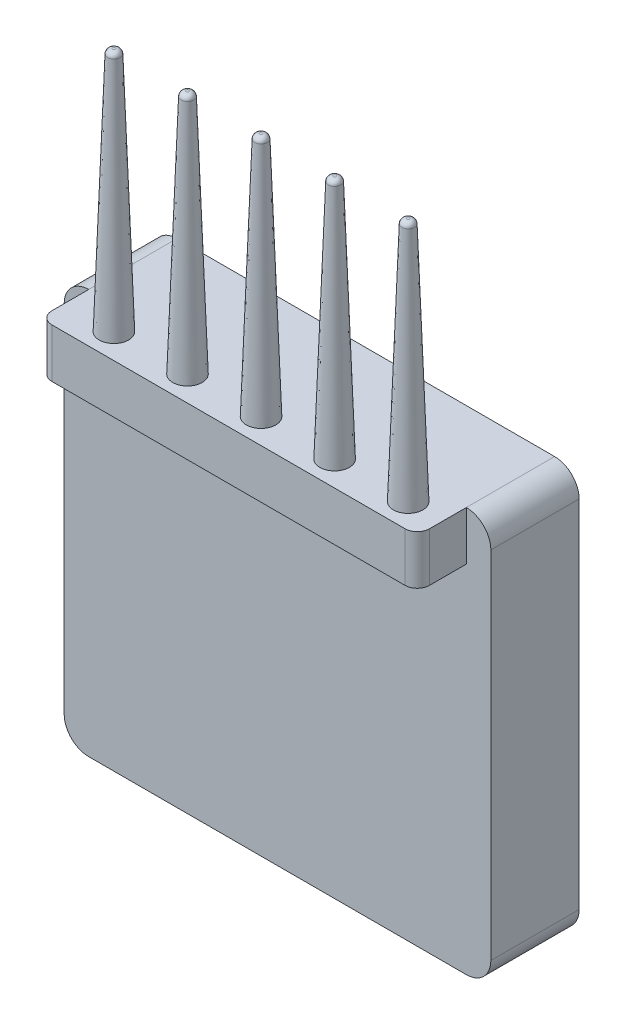
from build123d import *

# Parameters (mm, degrees)
EXTRUDE_1_DEPTH           = 36
SKETCH_3_W                = 154
SKETCH_3_H                = 20
EXTRUDE_4_DEPTH           = 20
SKETCH_4_R                = 6
EXTRUDE_5_DEPTH           = 100
EXTRUDE_5_DRAFT           = 2
EXTRUDE_5_PROFILE_2_DEPTH = 100
EXTRUDE_5_PROFILE_2_DRAFT = 2
EXTRUDE_5_PROFILE_3_DEPTH = 100
EXTRUDE_5_PROFILE_3_DRAFT = 2
EXTRUDE_5_PROFILE_4_DEPTH = 100
EXTRUDE_5_PROFILE_4_DRAFT = 2
EXTRUDE_5_PROFILE_5_DEPTH = 100
EXTRUDE_5_PROFILE_5_DRAFT = 2
FILLET_1_R                = 2
FILLET_2_R                = 5


with BuildPart() as part:
    # 스케치1 → 보스-돌출1 (new body)
    with BuildSketch(Plane.XY):
        with BuildLine():
            Line((-77, -82.5), (77, -82.5))
            ThreePointArc((77, -82.5), (84.071067812, -79.571067812), (87, -72.5))
            Line((87, -72.5), (87, 72.5))
            ThreePointArc((87, 72.5), (84.071067812, 79.571067812), (77, 82.5))
            Line((77, 82.5), (-77, 82.5))
            ThreePointArc((-77, 82.5), (-84.071067812, 79.571067812), (-87, 72.5))
            Line((-87, 72.5), (-87, -72.5))
            ThreePointArc((-87, -72.5), (-84.071067812, -79.571067812), (-77, -82.5))
        make_face()
    extrude(amount=EXTRUDE_1_DEPTH)

    # 스케치3 → 보스-돌출4 (add)
    with BuildSketch(Plane.XY.offset(36)):
        with Locations((0, 72.5)):
            Rectangle(SKETCH_3_W, SKETCH_3_H)
    extrude(amount=EXTRUDE_4_DEPTH)


with BuildPart() as extrude_5_tool:
    # 스케치4 → 보스-돌출5 (with draft: the straight prism first)
    with BuildSketch(Plane(origin=(0, 82.5, 0), x_dir=(1, 0, 0), z_dir=(0, 1, 0))):
        with Locations((-57, -45.716513986)):
            Circle(SKETCH_4_R)
    extrude(amount=EXTRUDE_5_DEPTH)
    # 보스-돌출5: the draft: its side faces are tilted about the plane it starts from
    extrude_5_sides = [extrude_5_tool.faces().sort_by_distance(p)[0] for p in [
        (-63, 132.5, 45.716513986),
    ]]
    draft(extrude_5_sides, Plane(origin=(0, 82.5, 0), x_dir=(1, 0, 0), z_dir=(0, 1, 0)), EXTRUDE_5_DRAFT)


with BuildPart() as part_1:
    add(part.part)

    # 보스-돌출5: add extrude_5_tool
    add(extrude_5_tool.part)


with BuildPart() as extrude_5_profile_2_tool:
    # 스케치4 → 보스-돌출5 profile 2 (with draft: the straight prism first)
    with BuildSketch(Plane(origin=(0, 82.5, 0), x_dir=(1, 0, 0), z_dir=(0, 1, 0))):
        with Locations((-27, -45.716513986)):
            Circle(SKETCH_4_R)
    extrude(amount=EXTRUDE_5_PROFILE_2_DEPTH)
    # 보스-돌출5 profile 2: the draft: its side faces are tilted about the plane it starts from
    extrude_5_profile_2_sides = [extrude_5_profile_2_tool.faces().sort_by_distance(p)[0] for p in [
        (-33, 132.5, 45.716513986),
    ]]
    draft(extrude_5_profile_2_sides, Plane(origin=(0, 82.5, 0), x_dir=(1, 0, 0), z_dir=(0, 1, 0)), EXTRUDE_5_PROFILE_2_DRAFT)


with BuildPart() as part_2:
    add(part_1.part)

    # 보스-돌출5 profile 2: add extrude_5_profile_2_tool
    add(extrude_5_profile_2_tool.part)


with BuildPart() as extrude_5_profile_3_tool:
    # 스케치4 → 보스-돌출5 profile 3 (with draft: the straight prism first)
    with BuildSketch(Plane(origin=(0, 82.5, 0), x_dir=(1, 0, 0), z_dir=(0, 1, 0))):
        with Locations((3, -45.716513986)):
            Circle(SKETCH_4_R)
    extrude(amount=EXTRUDE_5_PROFILE_3_DEPTH)
    # 보스-돌출5 profile 3: the draft: its side faces are tilted about the plane it starts from
    extrude_5_profile_3_sides = [extrude_5_profile_3_tool.faces().sort_by_distance(p)[0] for p in [
        (-3, 132.5, 45.716513986),
    ]]
    draft(extrude_5_profile_3_sides, Plane(origin=(0, 82.5, 0), x_dir=(1, 0, 0), z_dir=(0, 1, 0)), EXTRUDE_5_PROFILE_3_DRAFT)


with BuildPart() as part_3:
    add(part_2.part)

    # 보스-돌출5 profile 3: add extrude_5_profile_3_tool
    add(extrude_5_profile_3_tool.part)


with BuildPart() as extrude_5_profile_4_tool:
    # 스케치4 → 보스-돌출5 profile 4 (with draft: the straight prism first)
    with BuildSketch(Plane(origin=(0, 82.5, 0), x_dir=(1, 0, 0), z_dir=(0, 1, 0))):
        with Locations((33, -45.716513986)):
            Circle(SKETCH_4_R)
    extrude(amount=EXTRUDE_5_PROFILE_4_DEPTH)
    # 보스-돌출5 profile 4: the draft: its side faces are tilted about the plane it starts from
    extrude_5_profile_4_sides = [extrude_5_profile_4_tool.faces().sort_by_distance(p)[0] for p in [
        (27, 132.5, 45.716513986),
    ]]
    draft(extrude_5_profile_4_sides, Plane(origin=(0, 82.5, 0), x_dir=(1, 0, 0), z_dir=(0, 1, 0)), EXTRUDE_5_PROFILE_4_DRAFT)


with BuildPart() as part_4:
    add(part_3.part)

    # 보스-돌출5 profile 4: add extrude_5_profile_4_tool
    add(extrude_5_profile_4_tool.part)


with BuildPart() as extrude_5_profile_5_tool:
    # 스케치4 → 보스-돌출5 profile 5 (with draft: the straight prism first)
    with BuildSketch(Plane(origin=(0, 82.5, 0), x_dir=(1, 0, 0), z_dir=(0, 1, 0))):
        with Locations((63, -45.716513986)):
            Circle(SKETCH_4_R)
    extrude(amount=EXTRUDE_5_PROFILE_5_DEPTH)
    # 보스-돌출5 profile 5: the draft: its side faces are tilted about the plane it starts from
    extrude_5_profile_5_sides = [extrude_5_profile_5_tool.faces().sort_by_distance(p)[0] for p in [
        (57, 132.5, 45.716513986),
    ]]
    draft(extrude_5_profile_5_sides, Plane(origin=(0, 82.5, 0), x_dir=(1, 0, 0), z_dir=(0, 1, 0)), EXTRUDE_5_PROFILE_5_DRAFT)


with BuildPart() as part_5:
    add(part_4.part)

    # 보스-돌출5 profile 5: add extrude_5_profile_5_tool
    add(extrude_5_profile_5_tool.part)

    # 필렛1
    fillet_1_edges = [part_5.edges().sort_by_distance(p)[0] for p in [
        (-59.507923051, 182.5, 45.716513986),
        (-29.507923051, 182.5, 45.716513986),
        (0.492076949, 182.5, 45.716513986),
        (30.492076949, 182.5, 45.716513986),
        (60.492076949, 182.5, 45.716513986),
    ]]
    fillet(fillet_1_edges, radius=FILLET_1_R)

    # 필렛2
    fillet_2_edges = [part_5.edges().sort_by_distance(p)[0] for p in [
        (-77, 72.5, 56),
        (77, 72.5, 56),
    ]]
    fillet(fillet_2_edges, radius=FILLET_2_R)


solid = part_5.part
